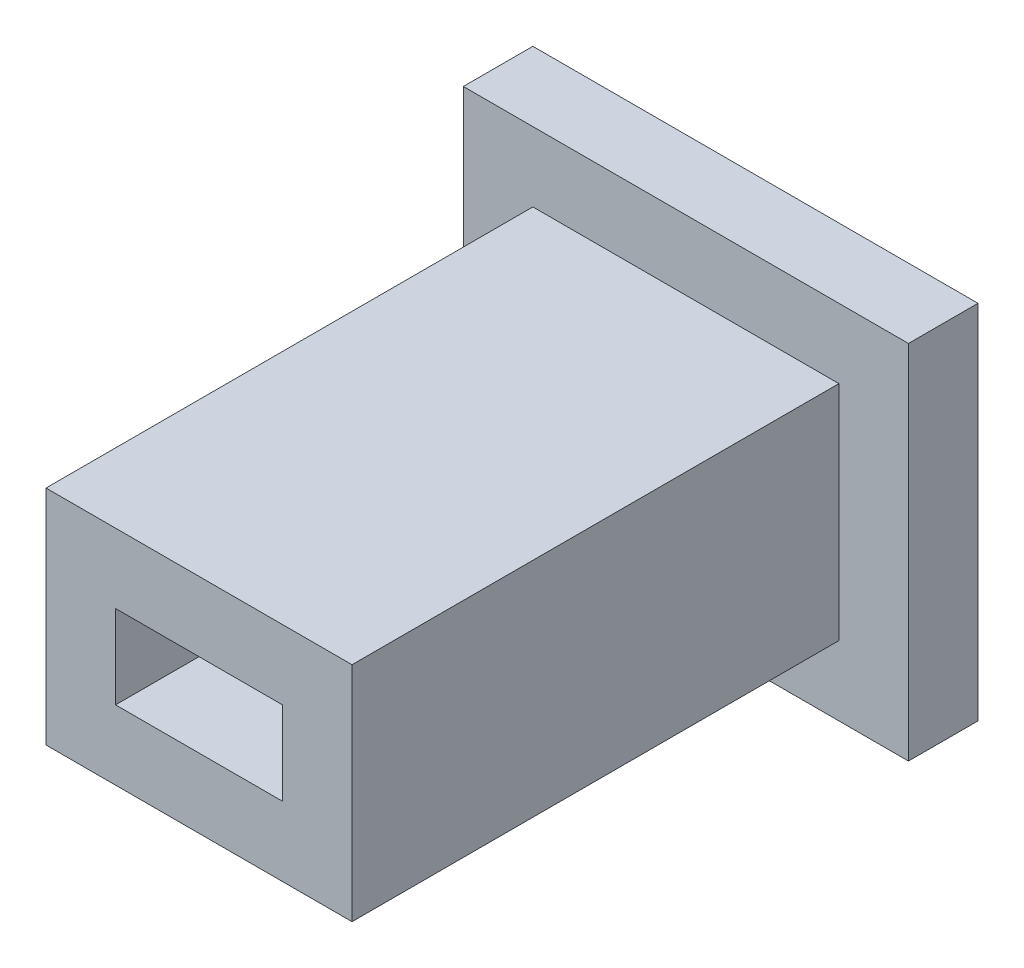
from build123d import *

# Parameters (mm, degrees)
SKETCH_1_W      = 44
SKETCH_1_H      = 32
SKETCH_1_W_2    = 24
SKETCH_1_H_2    = 12
EXTRUDE_1_DEPTH = 80
SKETCH_2_W      = 64
SKETCH_2_H      = 52
SKETCH_2_W_2    = 44
SKETCH_2_H_2    = 32
EXTRUDE_2_DEPTH = 10


with BuildPart() as part:
    # 草图1 → 凸台-拉伸1 (new body)
    with BuildSketch(Plane.XY):
        Rectangle(SKETCH_1_W, SKETCH_1_H)
        Rectangle(SKETCH_1_W_2, SKETCH_1_H_2, mode=Mode.SUBTRACT)
    extrude(amount=EXTRUDE_1_DEPTH)

    # 草图2 → 凸台-拉伸2 (add)
    with BuildSketch(Plane(origin=(0, 0, 0), x_dir=(-1, 0, 0), z_dir=(0, 0, -1))):
        Rectangle(SKETCH_2_W, SKETCH_2_H)
        Rectangle(SKETCH_2_W_2, SKETCH_2_H_2, mode=Mode.SUBTRACT)
    extrude(amount=-EXTRUDE_2_DEPTH)


solid = part.part
